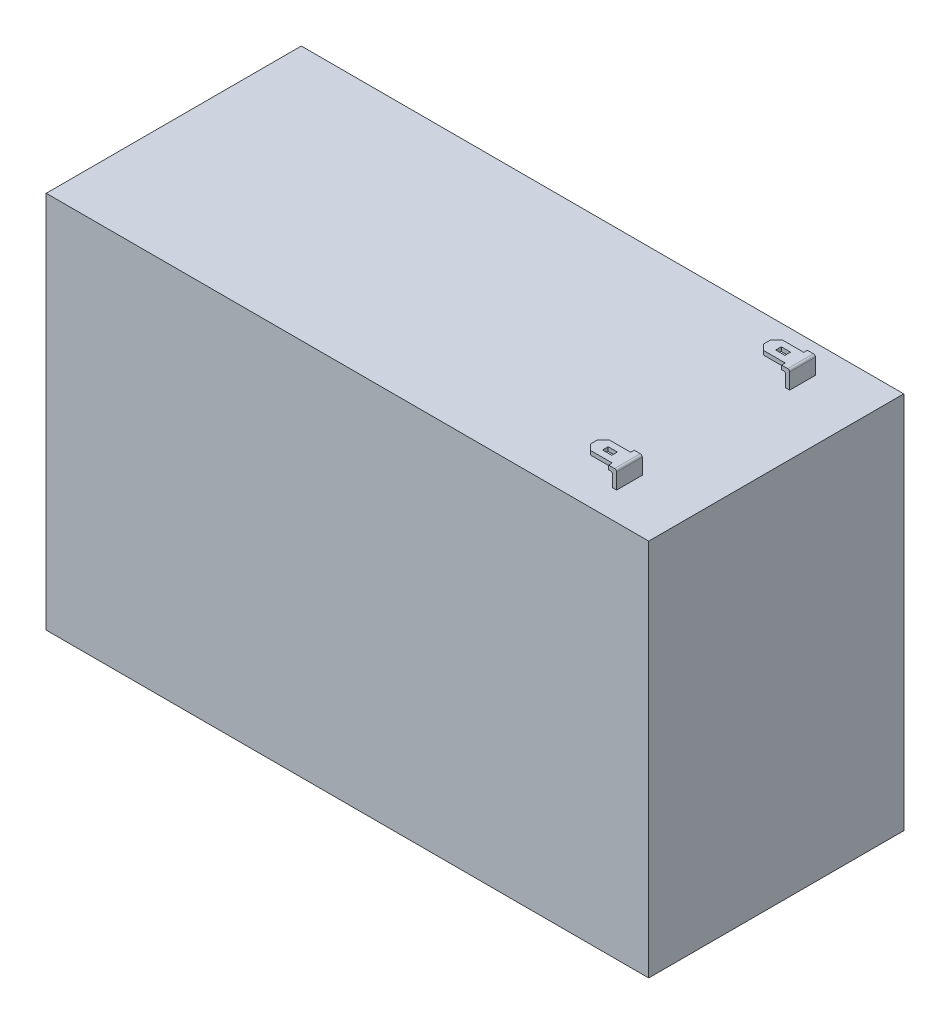
from build123d import *

# Parameters (mm, degrees)
SKETCH1_W           = 150
SKETCH1_H           = 63.5
BOSS_EXTRUDE1_DEPTH = 94.2
SKETCH3_W           = 2.3
SKETCH3_H           = 1.4
BOSS_EXTRUDE2_DEPTH = 4.4
SKETCH4_W           = 6.8
SKETCH4_H           = 3.4
CUT_EXTRUDE1_DEPTH  = 189.186636082


with BuildPart() as part:
    # Sketch1 → Boss-Extrude1 (new body)
    with BuildSketch(Plane(origin=(0, 0, 0), x_dir=(1, 0, 0), z_dir=(0, 1, 0))):
        with Locations((75, 31.75)):
            Rectangle(SKETCH1_W, SKETCH1_H)
    extrude(amount=BOSS_EXTRUDE1_DEPTH)

    # Sketch3 → Boss-Extrude2 (add)
    with BuildSketch(Plane(origin=(0, 94.2, 0), x_dir=(1, 0, 0), z_dir=(0, 1, 0))):
        Polygon((135, 7), (135, 13.4), (133, 13.4), (133, 12.5), (127.6, 12.5), (126.2, 11.1), (126.2, 9.3), (127.6, 7.9), (133, 7.9), (133, 7), align=None)
        with Locations((130.15, 10.2)):
            Rectangle(SKETCH3_W, SKETCH3_H, mode=Mode.SUBTRACT)
    boss_extrude2 = extrude(amount=BOSS_EXTRUDE2_DEPTH)

    # Sketch4 → Cut-Extrude1 (cut, through all)
    with BuildSketch(Plane.XY.offset(-7)):
        with Locations((129.6, 95.9)):
            Rectangle(SKETCH4_W, SKETCH4_H)
        with BuildLine():
            Line((133, 94.2), (134, 94.2))
            Line((134, 94.2), (134, 97.1))
            ThreePointArc((134, 97.1), (133.853553391, 97.453553391), (133.5, 97.6))
            Line((133.5, 97.6), (133, 97.6))
            Line((133, 97.6), (133, 94.2))
        make_face()
        with BuildLine():
            ThreePointArc((134.5, 98.6), (134.853553391, 98.453553391), (135, 98.1))
            Line((135, 98.1), (135, 98.6))
            Line((135, 98.6), (134.5, 98.6))
        make_face()
    cut_extrude1 = extrude(amount=-CUT_EXTRUDE1_DEPTH, mode=Mode.SUBTRACT)

    # Mirror1: Boss-Extrude2, Cut-Extrude1 across plane
    add(boss_extrude2.mirror(Plane.XY.offset(-31.75)))
    add(cut_extrude1.mirror(Plane.XY.offset(-31.75)), mode=Mode.SUBTRACT)


solid = part.part
